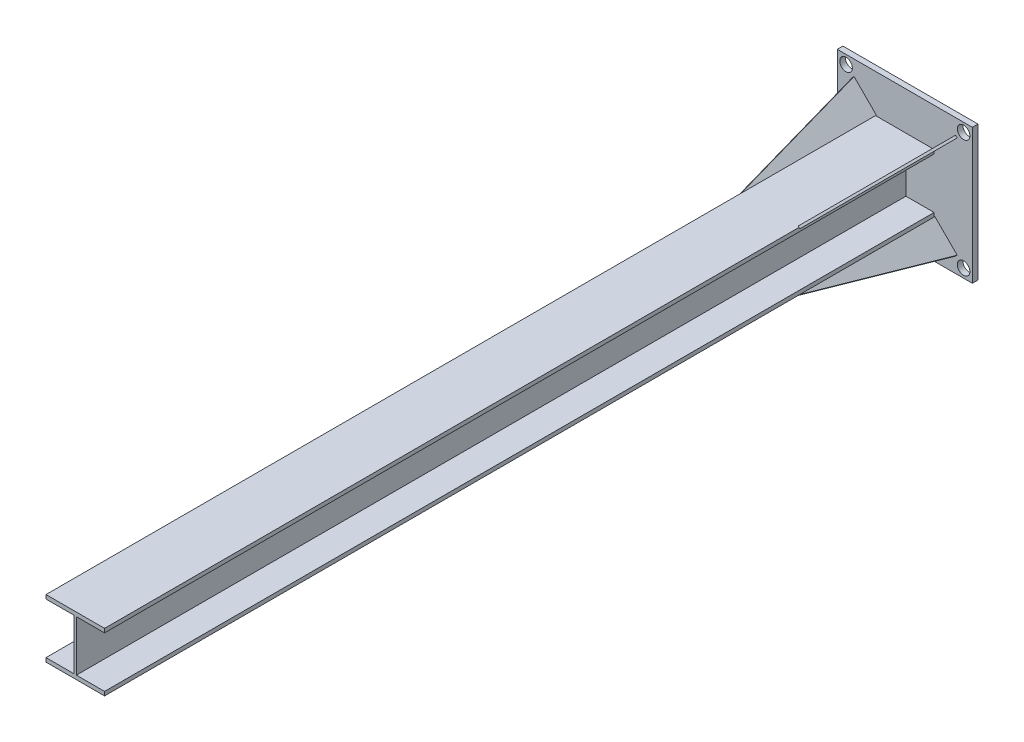
from build123d import *

# Parameters (mm, degrees)
BOSS_EXTRUDE1_DEPTH = 3684
SKETCH3_W           = 600
SKETCH3_H           = 600
BOSS_EXTRUDE2_DEPTH = 25
BOSS_EXTRUDE5_DEPTH = 5
CIRPATTERN3_COUNT   = 4
SKETCH6_R           = 28
CUT_EXTRUDE1_DEPTH  = 3734.852701969


with BuildPart() as part:
    # Sketch1 → Boss-Extrude1 (new body)
    with BuildSketch(Plane.XY):
        Polygon((-125, 242.5), (0, 242.5), (0, 260.0000001), (-260, 260.0000001), (-260, 242.5), (-135, 242.5), (-135, 17.5), (-260, 17.5), (-260, 0), (0, 0), (0, 17.5), (-125, 17.5), align=None)
    extrude(amount=BOSS_EXTRUDE1_DEPTH)


with BuildPart() as body_2:
    # Sketch3 → Boss-Extrude2 (new body)
    with BuildSketch(Plane.XY):
        with Locations((-130, 130)):
            Rectangle(SKETCH3_W, SKETCH3_H)
    extrude(amount=-BOSS_EXTRUDE2_DEPTH)

    # Sketch6 → Cut-Extrude1 (cut, through all)
    with BuildSketch(Plane.XY):
        with Locations((-391, 391)):
            Circle(SKETCH6_R)
        with Locations((131, 391)):
            Circle(SKETCH6_R)
        with Locations((131, -131)):
            Circle(SKETCH6_R)
        with Locations((-391, -131)):
            Circle(SKETCH6_R)
    extrude(amount=-CUT_EXTRUDE1_DEPTH, mode=Mode.SUBTRACT)


with BuildPart() as body_3:
    # Sketch5 → Boss-Extrude5 (new, symmetric)
    with BuildSketch(Plane(origin=(0, 0, 0), x_dir=(0.7071067811865477, -0.7071067811865475, 0), z_dir=(-0.7071067811865475, -0.7071067811865477, 0))):
        Polygon((0, 0), (140, 0), (0, 600), align=None)
    extrude(amount=BOSS_EXTRUDE5_DEPTH, both=True)


with BuildPart() as cirpattern3_1:
    # CirPattern3: pattern copy
    add(body_3.part.rotate(Axis((-130, 130.000000298, 3684), (0, 0, -1)), 1 * 360 / CIRPATTERN3_COUNT))


with BuildPart() as cirpattern3_2:
    # CirPattern3: pattern copy
    add(body_3.part.rotate(Axis((-130, 130.000000298, 3684), (0, 0, -1)), 2 * 360 / CIRPATTERN3_COUNT))


with BuildPart() as cirpattern3_3:
    # CirPattern3: pattern copy
    add(body_3.part.rotate(Axis((-130, 130.000000298, 3684), (0, 0, -1)), 3 * 360 / CIRPATTERN3_COUNT))


solid = Compound([part.part, body_2.part, body_3.part, cirpattern3_1.part, cirpattern3_2.part, cirpattern3_3.part])
